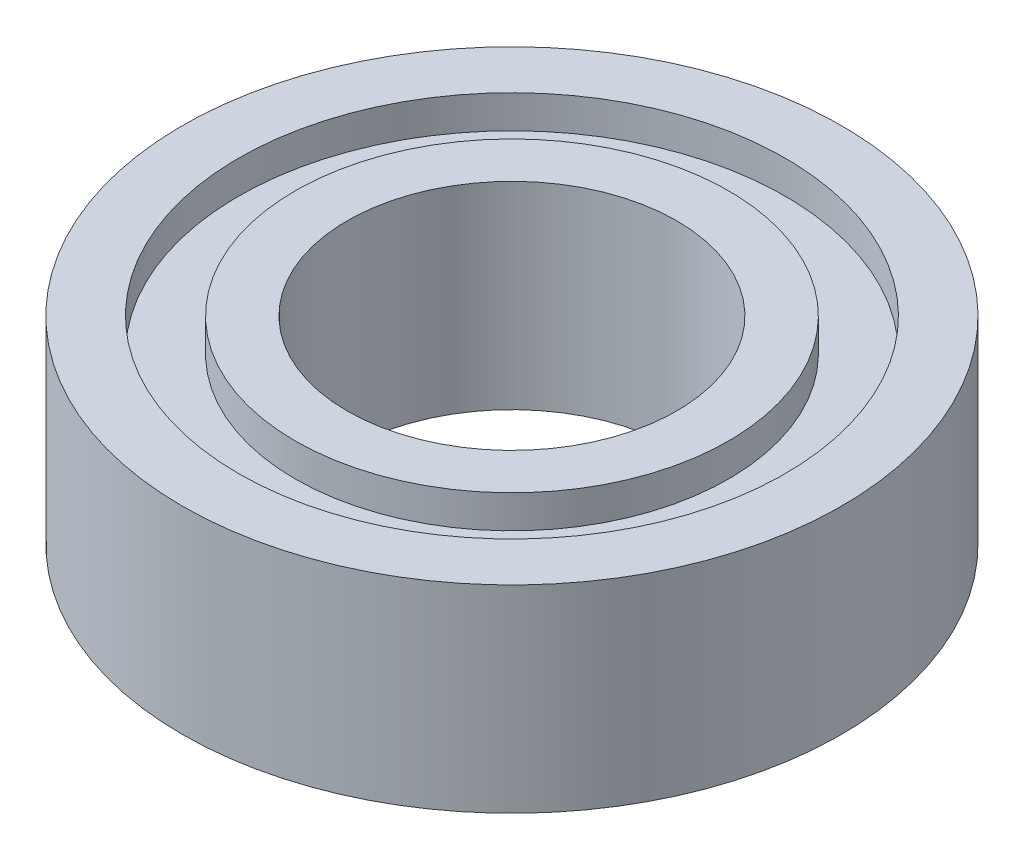
from build123d import *

# Parameters (mm, degrees)
SKETCH1_R           = 10
SKETCH1_R_2         = 5
BOSS_EXTRUDE1_DEPTH = 3
SKETCH2_R           = 8.292653498
SKETCH2_R_2         = 6.57478936
CUT_EXTRUDE1_DEPTH  = 1


with BuildPart() as part:
    # Sketch1 → Boss-Extrude1 (new, symmetric)
    with BuildSketch(Plane(origin=(0, 0, 0), x_dir=(1, 0, 0), z_dir=(0, 1, 0))):
        with Locations(Location((0, 0, 0), (0, 0, 270))):
            Circle(SKETCH1_R)
        with Locations(Location((0, 0, 0), (0, 0, 270))):
            Circle(SKETCH1_R_2, mode=Mode.SUBTRACT)
    extrude(amount=BOSS_EXTRUDE1_DEPTH, both=True)

    # Sketch2 → Cut-Extrude1 (cut)
    with BuildSketch(Plane(origin=(0, 3, 0), x_dir=(1, 0, 0), z_dir=(0, 1, 0))):
        with Locations(Location((0, 0, 0), (0, 0, 270))):
            Circle(SKETCH2_R)
        with Locations(Location((0, 0, 0), (0, 0, 270))):
            Circle(SKETCH2_R_2, mode=Mode.SUBTRACT)
    cut_extrude1 = extrude(amount=-CUT_EXTRUDE1_DEPTH, mode=Mode.SUBTRACT)

    # Mirror1: Cut-Extrude1 across plane
    add(cut_extrude1.mirror(Plane.ZX), mode=Mode.SUBTRACT)


solid = part.part
